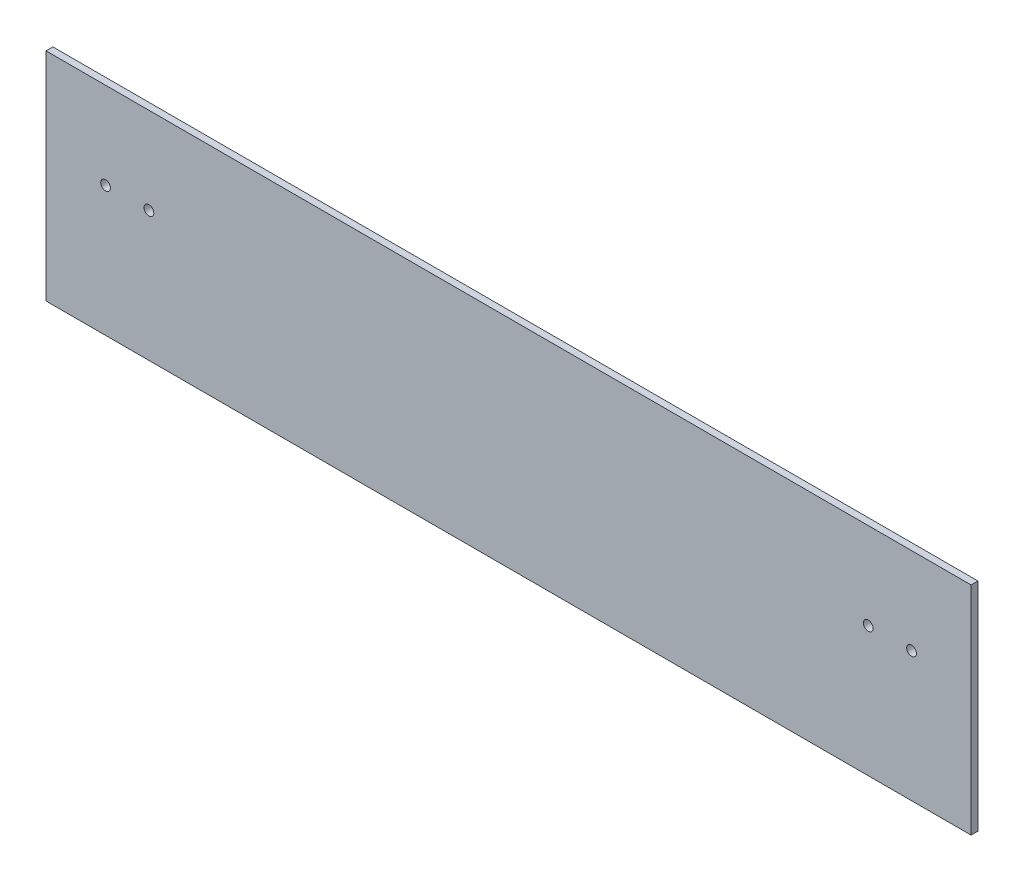
from build123d import *

# Parameters (mm, degrees)
SKETCH1_W           = 427
SKETCH1_H           = 100
BOSS_EXTRUDE1_DEPTH = 3.175
SKETCH2_R           = 2.25
CUT_EXTRUDE1_DEPTH  = 439.564796381


with BuildPart() as part:
    # Sketch1 → Boss-Extrude1 (new body)
    with BuildSketch(Plane.XY):
        with Locations((213.5, 50)):
            Rectangle(SKETCH1_W, SKETCH1_H)
    extrude(amount=BOSS_EXTRUDE1_DEPTH)

    # Sketch2 → Cut-Extrude1 (cut, through all)
    with BuildSketch(Plane(origin=(0, 0, 0), x_dir=(-1, 0, 0), z_dir=(0, 0, -1))):
        with Locations((-399.5, 60)):
            Circle(SKETCH2_R)
        with Locations((-379.5, 60)):
            Circle(SKETCH2_R)
        with Locations(Location((-27.5, 60, 0), (0, 0, 180))):
            Circle(SKETCH2_R)
        with Locations(Location((-47.5, 60, 0), (0, 0, 180))):
            Circle(SKETCH2_R)
    extrude(amount=-CUT_EXTRUDE1_DEPTH, mode=Mode.SUBTRACT)


solid = part.part
